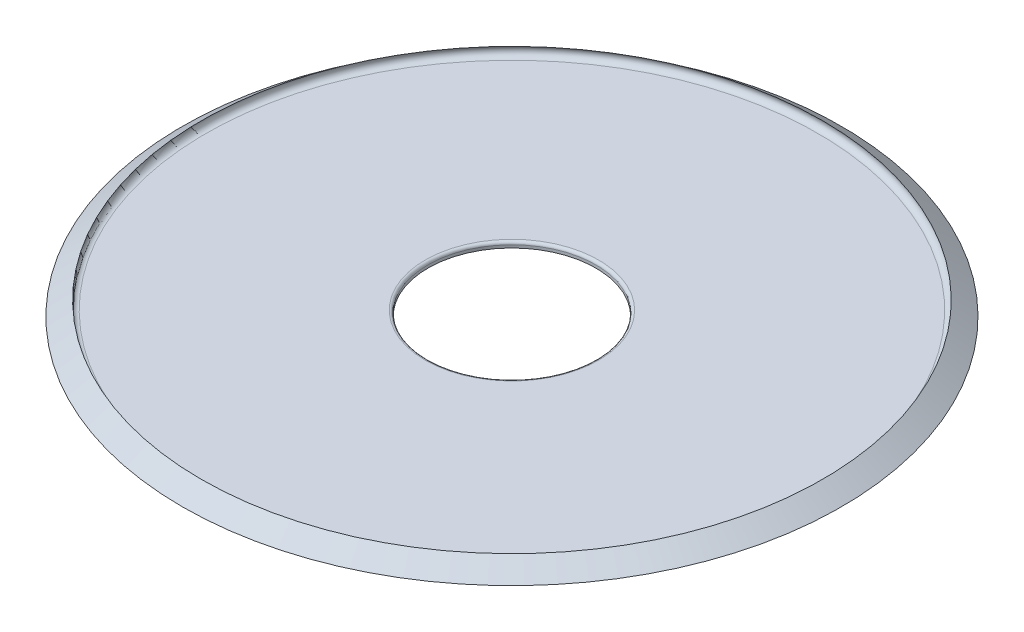
from build123d import *


with BuildPart() as part:
    # Sketch6 (on Front Plane) → iris (revolve)
    with BuildSketch(Plane.XY):
        with BuildLine():
            Line((5.548153632, 4.336060606), (5.886123402, 4.08))
            Line((5.886123402, 4.08), (5.492861113, 4.08))
            Line((5.492861113, 4.08), (1.5, 4.08))
            Line((1.5, 4.08), (1.5, 4.13))
            ThreePointArc((1.5, 4.13), (1.514644661, 4.165355339), (1.55, 4.18))
            Line((1.55, 4.18), (5.465345369, 4.18))
            ThreePointArc((5.465345369, 4.18), (5.553680131, 4.233128157), (5.548153632, 4.336060606))
        make_face()
    revolve(axis=Axis((0, 6.133234984, 0), (0, -1, 0)))


solid = part.part
